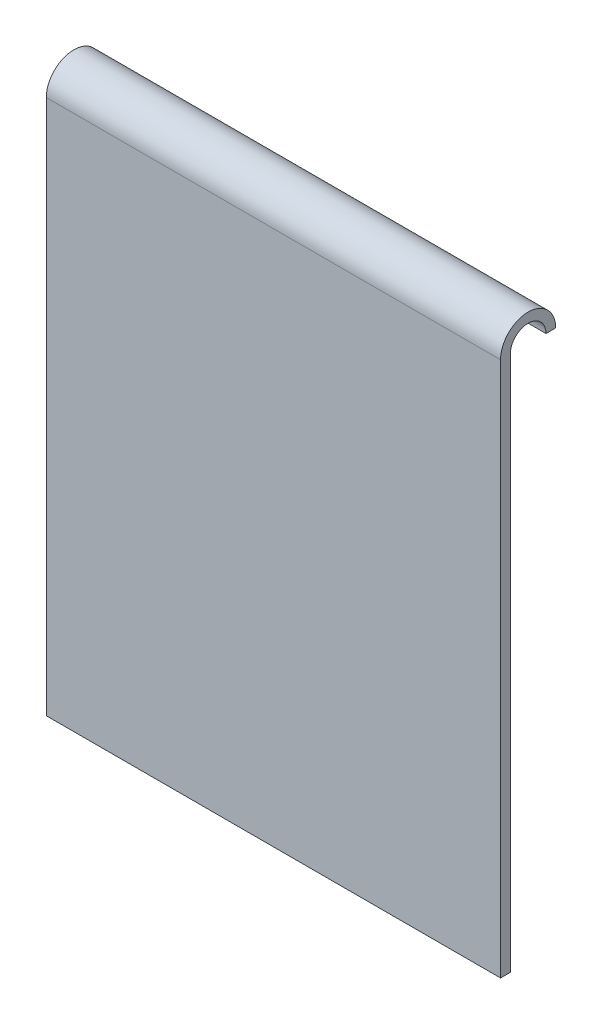
from build123d import *

# Parameters (mm, degrees)
EXTRUDE_1_DEPTH      = 7
EXTRUDE_1_DEPTH_BACK = 7


with BuildPart() as part:
    # 草圖1 → 填料-伸長1 (new, two sides: drawn at the far end of the back side and taken through both)
    with BuildSketch(Plane(origin=(0, 0, 0), x_dir=(0, 0, -1), z_dir=(1, 0, 0)).offset(-EXTRUDE_1_DEPTH_BACK)):
        with BuildLine():
            Line((-2.55, -4), (-2.55, -20.5))
            Line((-2.55, -20.5), (-2.25, -20.5))
            Line((-2.25, -20.5), (-2.25, -4))
            ThreePointArc((-2.25, -4), (-1.7, -3.45), (-1.15, -4))
            Line((-1.15, -4), (-0.85, -4))
            ThreePointArc((-0.85, -4), (-1.7, -3.15), (-2.55, -4))
        make_face()
    extrude(amount=EXTRUDE_1_DEPTH + EXTRUDE_1_DEPTH_BACK)


solid = part.part
